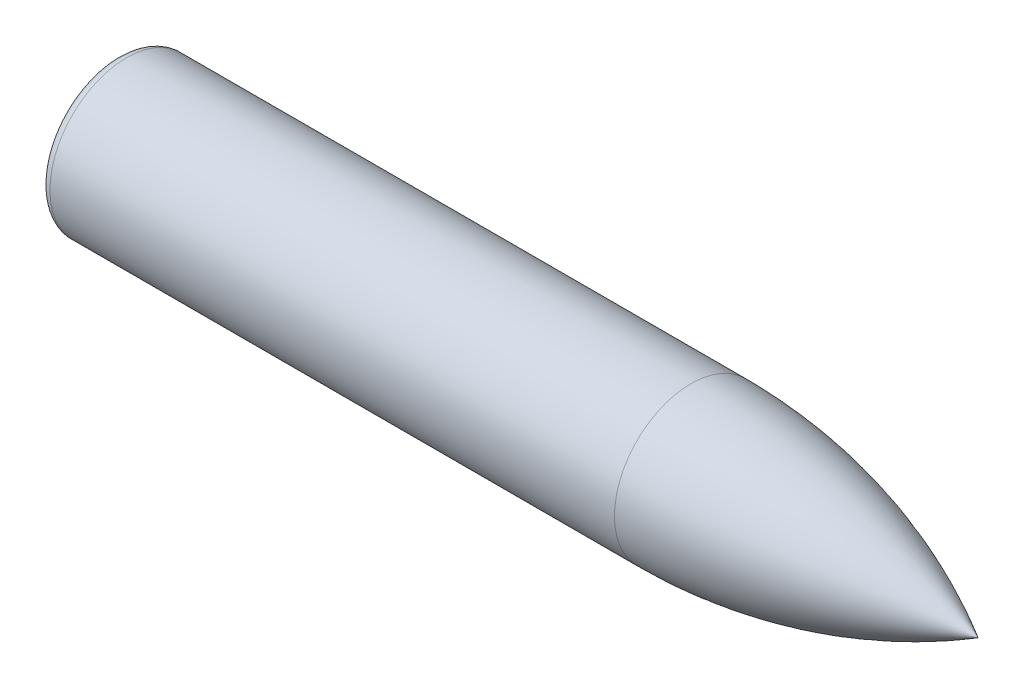
from build123d import *

# Parameters (mm, degrees)
RADYUS1_R = 20


with BuildPart() as part:
    # Çizim1 → Döndür1 (revolve)
    with BuildSketch(Plane.XY, mode=Mode.PRIVATE) as d_nd_r1_sk:
        with BuildLine():
            Line((0, 0), (0, 160))
            Line((0, 160), (1200, 160))
            ThreePointArc((1200, 160), (1510.483493925, 119.31310222), (1800, 0))
            Line((1800, 0), (0, 0))
        make_face()
    revolve(d_nd_r1_sk.sketch.rotate(Axis((0, 0, 0), (1, 0, 0)), 90), axis=Axis((0, 0, 0), (1, 0, 0)))

    # Radyus1
    radyus1_edges = [part.edges().sort_by_distance(p)[0] for p in [
        (0, 0, -160),
    ]]
    fillet(radyus1_edges, radius=RADYUS1_R)


solid = part.part
